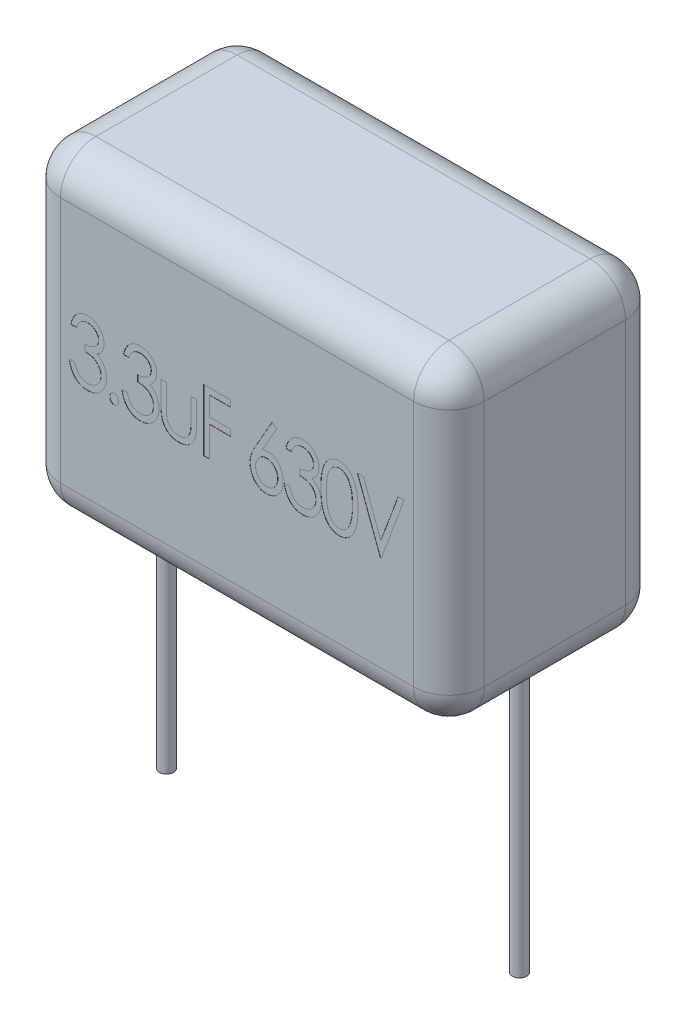
from build123d import *

# Parameters (mm, degrees)
BOSS_EXTRUDE1_DEPTH = 12
FILLET1_R           = 2
SKETCH2_R           = 0.4
BOSS_EXTRUDE2_DEPTH = 24
CUT_EXTRUDE1_DEPTH  = 0.01


with BuildPart() as part:
    # Sketch1 → Boss-Extrude1 (new, symmetric)
    with BuildSketch(Plane(origin=(0, 0, 0), x_dir=(0, 0, -1), z_dir=(1, 0, 0))):
        with BuildLine():
            Line((-4, 9), (4, 9))
            ThreePointArc((4, 9), (5.414213562, 8.414213562), (6, 7))
            Line((6, 7), (6, -7))
            ThreePointArc((6, -7), (5.414213562, -8.414213562), (4, -9))
            Line((4, -9), (-4, -9))
            ThreePointArc((-4, -9), (-5.414213562, -8.414213562), (-6, -7))
            Line((-6, -7), (-6, 7))
            ThreePointArc((-6, 7), (-5.414213562, 8.414213562), (-4, 9))
        make_face()
    extrude(amount=BOSS_EXTRUDE1_DEPTH, both=True)

    # Fillet1
    fillet1_edges = [part.edges().sort_by_distance(p)[0] for p in [
        (-12, 0, 6),
        (-12, 8.414213562, 5.414213562),
        (-12, 9, 0),
        (-12, 8.414213562, -5.414213562),
        (12, 8.414213562, 5.414213562),
        (12, 0, 6),
        (12, -8.414213562, 5.414213562),
        (12, -9, 0),
        (12, -8.414213562, -5.414213562),
        (12, 0, -6),
        (12, 8.414213562, -5.414213562),
        (-12, 0, -6),
        (12, 9, 0),
        (-12, -8.414213562, -5.414213562),
        (-12, -9, 0),
        (-12, -8.414213562, 5.414213562),
    ]]
    fillet(fillet1_edges, radius=FILLET1_R)

    # Sketch2 → Boss-Extrude2 (add)
    with BuildSketch(Plane(origin=(0, 0, 0), x_dir=(1, 0, 0), z_dir=(0, 1, 0))):
        with Locations(Location((10, 0, 0), (0, 0, 270))):
            Circle(SKETCH2_R)
        with Locations(Location((-10, 0, 0), (0, 0, 90))):
            Circle(SKETCH2_R)
    extrude(amount=-BOSS_EXTRUDE2_DEPTH)

    # Sketch3 → Cut-Extrude1 (cut)
    # profile 1 of 9: a face of its own
    with BuildSketch(Plane.XY.offset(6)):
        with BuildLine():
            Line((-9.104487179, 1.084449307), (-9.418589744, 1.084449307))
            add(Edge.make_bspline(
                [(-9.418589744, 1.084449307), (-9.410630849, 1.119621771), (-9.395115741, 1.188187152), (-9.364678553, 1.287066866), (-9.329026868, 1.379596381), (-9.288319285, 1.466091978), (-9.242881043, 1.546628643), (-9.191150702, 1.62031441), (-9.135523276, 1.688942013), (-9.073270229, 1.749431821), (-9.008482805, 1.804670638), (-8.939410705, 1.851330848), (-8.868133663, 1.891940262), (-8.7937364, 1.924991002), (-8.716119059, 1.950208155), (-8.635639902, 1.968433398), (-8.552344374, 1.980081874), (-8.495718117, 1.981280742), (-8.467167468, 1.981885204)],
                knots=[0, 0, 0, 0, 1.213646873, 2.365889363, 3.479226314, 4.54912843, 5.581579656, 6.587705624, 7.576924878, 8.55050232, 9.505464024, 10.439453725, 11.351887816, 12.264152294, 13.174752891, 14.094686289, 15.039351257, 16, 16, 16, 16], degree=3))
            add(Edge.make_bspline(
                [(-8.467167468, 1.981885204), (-8.425449637, 1.980492873), (-8.34271839, 1.977731719), (-8.221304333, 1.95285661), (-8.104287154, 1.91317393), (-7.992861731, 1.858728578), (-7.889349447, 1.791278593), (-7.797213807, 1.711402472), (-7.718079578, 1.620160897), (-7.652495716, 1.519084123), (-7.600279132, 1.411804455), (-7.56187533, 1.301052171), (-7.538541965, 1.18755313), (-7.535500608, 1.110964723), (-7.533974359, 1.072530236)],
                knots=[0, 0, 0, 0, 1.037475548, 2.057433109, 3.071083532, 4.106583696, 5.136003477, 6.138035553, 7.131860785, 8.132253496, 9.128731291, 10.094580144, 11.043800018, 12, 12, 12, 12], degree=3))
            add(Edge.make_bspline(
                [(-7.533974359, 1.072530236), (-7.535184897, 1.035527594), (-7.537552391, 0.963160107), (-7.556183875, 0.857560228), (-7.587073963, 0.757791469), (-7.630911491, 0.664045362), (-7.686931658, 0.57606498), (-7.75555274, 0.494633183), (-7.836120926, 0.418600102), (-7.897295303, 0.374910855), (-7.928705929, 0.352478153)],
                knots=[0, 0, 0, 0, 1.034740432, 2.023681557, 2.989439786, 3.948891607, 4.910213012, 5.898894732, 6.921165452, 8, 8, 8, 8], degree=3))
            add(Edge.make_bspline(
                [(-7.928705929, 0.352478153), (-7.895208912, 0.334416009), (-7.828339892, 0.298359129), (-7.737736103, 0.228658559), (-7.655769576, 0.147586852), (-7.610288743, 0.08532595), (-7.587259615, 0.053800268)],
                knots=[0, 0, 0, 0, 0.994457701, 1.985203988, 2.979812114, 4, 4, 4, 4], degree=3))
            add(Edge.make_bspline(
                [(-7.587259615, 0.053800268), (-7.572095275, 0.030689639), (-7.541895784, -0.015334731), (-7.504689681, -0.088567443), (-7.471887283, -0.163317834), (-7.445333873, -0.240206226), (-7.424971341, -0.319265714), (-7.410290328, -0.400331456), (-7.400777879, -0.483499262), (-7.399833718, -0.539790424), (-7.399358974, -0.568094764)],
                knots=[0, 0, 0, 0, 1.00515716, 2.001751025, 2.984458985, 3.97420733, 4.958128942, 5.952324961, 6.970387383, 8, 8, 8, 8], degree=3))
            add(Edge.make_bspline(
                [(-7.399358974, -0.568094764), (-7.401227248, -0.617043772), (-7.404945278, -0.714456593), (-7.431441341, -0.859093824), (-7.476977552, -0.99954047), (-7.538235862, -1.135005692), (-7.614423862, -1.261173268), (-7.705000809, -1.374109033), (-7.808800459, -1.471687046), (-7.924880272, -1.552972722), (-8.050602099, -1.61821072), (-8.18526605, -1.66330333), (-8.326824664, -1.692906122), (-8.424013034, -1.696018112), (-8.473477564, -1.697601975)],
                knots=[0, 0, 0, 0, 1.014707837, 2.019357588, 3.036907717, 4.069166202, 5.095504868, 6.084608755, 7.061626644, 8.038980938, 9.014218756, 9.987287233, 10.975619287, 12, 12, 12, 12], degree=3))
            add(Edge.make_bspline(
                [(-8.473477564, -1.697601975), (-8.506693909, -1.696739553), (-8.571942084, -1.695045463), (-8.667859233, -1.683306668), (-8.759270158, -1.661923167), (-8.846639675, -1.633216243), (-8.930062443, -1.5964789), (-9.009452367, -1.551717486), (-9.084222141, -1.49786651), (-9.154292883, -1.435985015), (-9.219782568, -1.366634156), (-9.27876922, -1.288809293), (-9.332148008, -1.203588951), (-9.379783947, -1.110959908), (-9.421250538, -1.010517011), (-9.456761192, -0.902716456), (-9.486441617, -0.786975079), (-9.500898371, -0.706789383), (-9.508333333, -0.665550693)],
                knots=[0, 0, 0, 0, 0.990513423, 1.945704551, 2.875515556, 3.785713825, 4.684393021, 5.589454026, 6.498450854, 7.426798081, 8.373433753, 9.338011181, 10.333830724, 11.368661367, 12.440314751, 13.570898844, 14.750737914, 16, 16, 16, 16], degree=3))
            Line((-9.508333333, -0.665550693), (-9.194230769, -0.665550693))
            add(Edge.make_bspline(
                [(-9.194230769, -0.665550693), (-9.187553589, -0.692522395), (-9.174568719, -0.744973284), (-9.150148472, -0.819755632), (-9.125642197, -0.889488329), (-9.097259177, -0.952758664), (-9.067218088, -1.010465925), (-9.035000825, -1.062748731), (-9.000278538, -1.109056569), (-8.974563297, -1.136221585), (-8.962159455, -1.149324732)],
                knots=[0, 0, 0, 0, 1.227409514, 2.386898646, 3.474821375, 4.49196229, 5.448190758, 6.348047463, 7.203174547, 8, 8, 8, 8], degree=3))
            add(Edge.make_bspline(
                [(-8.962159455, -1.149324732), (-8.945612096, -1.164387947), (-8.91283868, -1.194221892), (-8.858951896, -1.232827914), (-8.802300062, -1.266404533), (-8.741265914, -1.291685347), (-8.678032605, -1.313468303), (-8.610924314, -1.327678323), (-8.540599717, -1.337320724), (-8.492442418, -1.338186053), (-8.46786859, -1.338627616)],
                knots=[0, 0, 0, 0, 0.987786239, 1.956392453, 2.923291289, 3.889914458, 4.869410071, 5.873943724, 6.915110651, 8, 8, 8, 8], degree=3))
            add(Edge.make_bspline(
                [(-8.46786859, -1.338627616), (-8.440014216, -1.33802707), (-8.385733207, -1.33685676), (-8.306531859, -1.325605303), (-8.231250222, -1.309686576), (-8.16068096, -1.284243051), (-8.093424359, -1.253848391), (-8.03113643, -1.214952312), (-7.972967352, -1.169485989), (-7.919412734, -1.118015991), (-7.871584216, -1.061470887), (-7.829317215, -1.002419283), (-7.792922407, -0.941256463), (-7.764615467, -0.87692417), (-7.740811088, -0.810852492), (-7.724857821, -0.741907377), (-7.71578781, -0.67070165), (-7.714242681, -0.622574022), (-7.713461538, -0.598243001)],
                knots=[0, 0, 0, 0, 1.131388683, 2.204785482, 3.246441662, 4.252851856, 5.247356788, 6.241181003, 7.22926868, 8.243715995, 9.254465245, 10.235036049, 11.192984918, 12.141087045, 13.087426855, 14.043631555, 15.010953923, 16, 16, 16, 16], degree=3))
            add(Edge.make_bspline(
                [(-7.713461538, -0.598243001), (-7.714656893, -0.56566472), (-7.717033722, -0.500886478), (-7.736710516, -0.405583378), (-7.768397271, -0.313598154), (-7.812725247, -0.226394272), (-7.866750214, -0.145568417), (-7.930142032, -0.073635542), (-8.00340136, -0.013730792), (-8.071342626, 0.027935112), (-8.1317229, 0.055665105), (-8.182973746, 0.074697685), (-8.240168963, 0.090282198), (-8.302740463, 0.105301445), (-8.371578737, 0.117702947), (-8.446207718, 0.128010123), (-8.526639941, 0.136556776), (-8.582135361, 0.140235178), (-8.610897436, 0.142141615)],
                knots=[0, 0, 0, 0, 1.19277501, 2.371698767, 3.54972029, 4.748382554, 5.945391955, 7.103829679, 8.24739154, 9.400245482, 10.013276171, 10.679775806, 11.400814213, 12.18386578, 13.037095876, 13.962316118, 14.943912534, 16, 16, 16, 16], degree=3))
            Line((-8.610897436, 0.142141615), (-8.610897436, 0.501115974))
            add(Edge.make_bspline(
                [(-8.610897436, 0.501115974), (-8.57413237, 0.501870988), (-8.50186619, 0.50335506), (-8.396577428, 0.520596125), (-8.295637834, 0.545184775), (-8.201637256, 0.581649017), (-8.115917131, 0.625078056), (-8.041381158, 0.674621633), (-7.979950446, 0.73075846), (-7.930939729, 0.792440597), (-7.893728279, 0.858444719), (-7.867591621, 0.927771859), (-7.850459119, 0.999712964), (-7.848875171, 1.049062326), (-7.848076923, 1.07393248)],
                knots=[0, 0, 0, 0, 1.243740816, 2.444722913, 3.604071008, 4.756374622, 5.850061341, 6.853181308, 7.777365241, 8.656145985, 9.510167359, 10.331781837, 11.159283104, 12, 12, 12, 12], degree=3))
            add(Edge.make_bspline(
                [(-7.848076923, 1.07393248), (-7.848601087, 1.092195382), (-7.849641623, 1.128449715), (-7.858368678, 1.181525952), (-7.871852444, 1.232981654), (-7.890482799, 1.282555083), (-7.915627078, 1.330054011), (-7.945740036, 1.375759282), (-7.981768652, 1.419175718), (-8.022450187, 1.460310839), (-8.066581267, 1.499000594), (-8.115298077, 1.531567216), (-8.166206468, 1.560197508), (-8.2200405, 1.583189796), (-8.276920766, 1.600884619), (-8.336561387, 1.613312564), (-8.399182437, 1.62123049), (-8.441903119, 1.622343805), (-8.463661859, 1.622910845)],
                knots=[0, 0, 0, 0, 0.954298075, 1.894410913, 2.804261135, 3.732387345, 4.655998667, 5.60826082, 6.589174048, 7.600068601, 8.631142096, 9.651225118, 10.65760524, 11.681194716, 12.705294547, 13.766901717, 14.862625692, 16, 16, 16, 16], degree=3))
            add(Edge.make_bspline(
                [(-8.463661859, 1.622910845), (-8.498624483, 1.621522296), (-8.567018845, 1.618805997), (-8.665547842, 1.594774807), (-8.757097116, 1.55666438), (-8.826657127, 1.511339593), (-8.877684738, 1.466535783), (-8.914941375, 1.42799586), (-8.950289103, 1.383679424), (-8.984447879, 1.334353339), (-9.016372449, 1.279072212), (-9.048365355, 1.219619238), (-9.077625723, 1.15407544), (-9.095348617, 1.108136883), (-9.104487179, 1.084449307)],
                knots=[0, 0, 0, 0, 1.395445339, 2.729789254, 4.027341734, 5.343352216, 6.025171276, 6.738565338, 7.482488129, 8.288221053, 9.133992859, 10.032284056, 10.985374711, 12, 12, 12, 12], degree=3))
        make_face()
    # profile 2 of 9: a face of its own
    with BuildSketch(Plane.XY.offset(6)):
        with BuildLine():
            add(Edge.make_bspline(
                [(-6.964102564, -1.069396847), (-6.947625024, -1.070552001), (-6.915098748, -1.072832249), (-6.86804703, -1.08889449), (-6.825363603, -1.116333061), (-6.78796813, -1.153707634), (-6.756580334, -1.197981827), (-6.733979206, -1.248235378), (-6.719125881, -1.302957771), (-6.717925142, -1.341331044), (-6.717307692, -1.361063514)],
                knots=[0, 0, 0, 0, 0.932051743, 1.839848197, 2.779380411, 3.780329255, 4.815317283, 5.833513928, 6.885940208, 8, 8, 8, 8], degree=3))
            add(Edge.make_bspline(
                [(-6.717307692, -1.361063514), (-6.717964096, -1.380322443), (-6.719255634, -1.41821624), (-6.733945384, -1.472511656), (-6.756785116, -1.522835575), (-6.787730838, -1.567636718), (-6.825366073, -1.60514347), (-6.868187728, -1.632340573), (-6.914949943, -1.649500061), (-6.947600749, -1.651645745), (-6.964102564, -1.65273018)],
                knots=[0, 0, 0, 0, 1.089197406, 2.143100788, 3.162726492, 4.210031689, 5.212385385, 6.153236251, 7.066640104, 8, 8, 8, 8], degree=3))
            add(Edge.make_bspline(
                [(-6.964102564, -1.65273018), (-6.980604379, -1.651645745), (-7.013255185, -1.649500061), (-7.0600174, -1.632340573), (-7.102839055, -1.60514347), (-7.14047429, -1.567636718), (-7.171420012, -1.522835575), (-7.194259744, -1.472511656), (-7.208949494, -1.41821624), (-7.210241032, -1.380322443), (-7.210897436, -1.361063514)],
                knots=[0, 0, 0, 0, 0.933359896, 1.846763749, 2.787614615, 3.789968311, 4.837273508, 5.856899212, 6.910802594, 8, 8, 8, 8], degree=3))
            add(Edge.make_bspline(
                [(-7.210897436, -1.361063514), (-7.210279987, -1.341331044), (-7.209079247, -1.302957771), (-7.194225922, -1.248235378), (-7.171624794, -1.197981827), (-7.140236998, -1.153707634), (-7.102841525, -1.116333061), (-7.060158098, -1.08889449), (-7.013106381, -1.072832249), (-6.980580104, -1.070552001), (-6.964102564, -1.069396847)],
                knots=[0, 0, 0, 0, 1.114059792, 2.166486072, 3.184682717, 4.219670745, 5.220619589, 6.160151803, 7.067948257, 8, 8, 8, 8], degree=3))
        make_face()
    # profile 3 of 9: a face of its own
    with BuildSketch(Plane.XY.offset(6)):
        with BuildLine():
            Line((-6.125, 1.084449307), (-6.439102564, 1.084449307))
            add(Edge.make_bspline(
                [(-6.439102564, 1.084449307), (-6.43114367, 1.119621771), (-6.415628562, 1.188187152), (-6.385191374, 1.287066866), (-6.349539689, 1.379596381), (-6.308832105, 1.466091978), (-6.263393864, 1.546628643), (-6.211663522, 1.62031441), (-6.156036097, 1.688942013), (-6.093783049, 1.749431821), (-6.028995625, 1.804670638), (-5.959923525, 1.851330848), (-5.888646483, 1.891940262), (-5.81424922, 1.924991002), (-5.736631879, 1.950208155), (-5.656152723, 1.968433398), (-5.572857195, 1.980081874), (-5.516230937, 1.981280742), (-5.487680288, 1.981885204)],
                knots=[0, 0, 0, 0, 1.213646873, 2.365889363, 3.479226314, 4.54912843, 5.581579656, 6.587705624, 7.576924878, 8.55050232, 9.505464024, 10.439453725, 11.351887816, 12.264152294, 13.174752891, 14.094686289, 15.039351257, 16, 16, 16, 16], degree=3))
            add(Edge.make_bspline(
                [(-5.487680288, 1.981885204), (-5.445962458, 1.980492873), (-5.363231211, 1.977731719), (-5.241817154, 1.95285661), (-5.124799974, 1.91317393), (-5.013374551, 1.858728578), (-4.909862267, 1.791278593), (-4.817726627, 1.711402472), (-4.738592399, 1.620160897), (-4.673008536, 1.519084123), (-4.620791953, 1.411804455), (-4.582388151, 1.301052171), (-4.559054785, 1.18755313), (-4.556013429, 1.110964723), (-4.554487179, 1.072530236)],
                knots=[0, 0, 0, 0, 1.037475548, 2.057433109, 3.071083532, 4.106583696, 5.136003477, 6.138035553, 7.131860785, 8.132253496, 9.128731291, 10.094580144, 11.043800018, 12, 12, 12, 12], degree=3))
            add(Edge.make_bspline(
                [(-4.554487179, 1.072530236), (-4.555697717, 1.035527594), (-4.558065212, 0.963160107), (-4.576696695, 0.857560228), (-4.607586783, 0.757791469), (-4.651424312, 0.664045362), (-4.707444478, 0.57606498), (-4.77606556, 0.494633183), (-4.856633746, 0.418600102), (-4.917808124, 0.374910855), (-4.94921875, 0.352478153)],
                knots=[0, 0, 0, 0, 1.034740432, 2.023681557, 2.989439786, 3.948891607, 4.910213012, 5.898894732, 6.921165452, 8, 8, 8, 8], degree=3))
            add(Edge.make_bspline(
                [(-4.94921875, 0.352478153), (-4.915721733, 0.334416009), (-4.848852713, 0.298359129), (-4.758248923, 0.228658559), (-4.676282397, 0.147586852), (-4.630801564, 0.08532595), (-4.607772436, 0.053800268)],
                knots=[0, 0, 0, 0, 0.994457701, 1.985203988, 2.979812114, 4, 4, 4, 4], degree=3))
            add(Edge.make_bspline(
                [(-4.607772436, 0.053800268), (-4.592608095, 0.030689639), (-4.562408604, -0.015334731), (-4.525202501, -0.088567443), (-4.492400103, -0.163317834), (-4.465846693, -0.240206226), (-4.445484161, -0.319265714), (-4.430803149, -0.400331456), (-4.421290699, -0.483499262), (-4.420346538, -0.539790424), (-4.419871795, -0.568094764)],
                knots=[0, 0, 0, 0, 1.00515716, 2.001751025, 2.984458985, 3.97420733, 4.958128942, 5.952324961, 6.970387383, 8, 8, 8, 8], degree=3))
            add(Edge.make_bspline(
                [(-4.419871795, -0.568094764), (-4.421740069, -0.617043772), (-4.425458098, -0.714456593), (-4.451954162, -0.859093824), (-4.497490372, -0.99954047), (-4.558748682, -1.135005692), (-4.634936683, -1.261173268), (-4.725513629, -1.374109033), (-4.829313279, -1.471687046), (-4.945393092, -1.552972722), (-5.07111492, -1.61821072), (-5.20577887, -1.66330333), (-5.347337485, -1.692906122), (-5.444525854, -1.696018112), (-5.493990385, -1.697601975)],
                knots=[0, 0, 0, 0, 1.014707837, 2.019357588, 3.036907717, 4.069166202, 5.095504868, 6.084608755, 7.061626644, 8.038980938, 9.014218756, 9.987287233, 10.975619287, 12, 12, 12, 12], degree=3))
            add(Edge.make_bspline(
                [(-5.493990385, -1.697601975), (-5.527206729, -1.696739553), (-5.592454904, -1.695045463), (-5.688372054, -1.683306668), (-5.779782979, -1.661923167), (-5.867152495, -1.633216243), (-5.950575263, -1.5964789), (-6.029965187, -1.551717486), (-6.104734962, -1.49786651), (-6.174805704, -1.435985015), (-6.240295388, -1.366634156), (-6.29928204, -1.288809293), (-6.352660829, -1.203588951), (-6.400296768, -1.110959908), (-6.441763358, -1.010517011), (-6.477274012, -0.902716456), (-6.506954437, -0.786975079), (-6.521411192, -0.706789383), (-6.528846154, -0.665550693)],
                knots=[0, 0, 0, 0, 0.990513423, 1.945704551, 2.875515556, 3.785713825, 4.684393021, 5.589454026, 6.498450854, 7.426798081, 8.373433753, 9.338011181, 10.333830724, 11.368661367, 12.440314751, 13.570898844, 14.750737914, 16, 16, 16, 16], degree=3))
            Line((-6.528846154, -0.665550693), (-6.21474359, -0.665550693))
            add(Edge.make_bspline(
                [(-6.21474359, -0.665550693), (-6.208066409, -0.692522395), (-6.195081539, -0.744973284), (-6.170661293, -0.819755632), (-6.146155017, -0.889488329), (-6.117771998, -0.952758664), (-6.087730909, -1.010465925), (-6.055513645, -1.062748731), (-6.020791358, -1.109056569), (-5.995076118, -1.136221585), (-5.982672276, -1.149324732)],
                knots=[0, 0, 0, 0, 1.227409514, 2.386898646, 3.474821375, 4.49196229, 5.448190758, 6.348047463, 7.203174547, 8, 8, 8, 8], degree=3))
            add(Edge.make_bspline(
                [(-5.982672276, -1.149324732), (-5.966124916, -1.164387947), (-5.933351501, -1.194221892), (-5.879464716, -1.232827914), (-5.822812882, -1.266404533), (-5.761778734, -1.291685347), (-5.698545425, -1.313468303), (-5.631437135, -1.327678323), (-5.561112537, -1.337320724), (-5.512955238, -1.338186053), (-5.48838141, -1.338627616)],
                knots=[0, 0, 0, 0, 0.987786239, 1.956392453, 2.923291289, 3.889914458, 4.869410071, 5.873943724, 6.915110651, 8, 8, 8, 8], degree=3))
            add(Edge.make_bspline(
                [(-5.48838141, -1.338627616), (-5.460527036, -1.33802707), (-5.406246027, -1.33685676), (-5.32704468, -1.325605303), (-5.251763042, -1.309686576), (-5.18119378, -1.284243051), (-5.113937179, -1.253848391), (-5.051649251, -1.214952312), (-4.993480172, -1.169485989), (-4.939925554, -1.118015991), (-4.892097037, -1.061470887), (-4.849830035, -1.002419283), (-4.813435227, -0.941256463), (-4.785128288, -0.87692417), (-4.761323909, -0.810852492), (-4.745370641, -0.741907377), (-4.73630063, -0.67070165), (-4.734755502, -0.622574022), (-4.733974359, -0.598243001)],
                knots=[0, 0, 0, 0, 1.131388683, 2.204785482, 3.246441662, 4.252851856, 5.247356788, 6.241181003, 7.22926868, 8.243715995, 9.254465245, 10.235036049, 11.192984918, 12.141087045, 13.087426855, 14.043631555, 15.010953923, 16, 16, 16, 16], degree=3))
            add(Edge.make_bspline(
                [(-4.733974359, -0.598243001), (-4.735169714, -0.56566472), (-4.737546542, -0.500886478), (-4.757223336, -0.405583378), (-4.788910091, -0.313598154), (-4.833238068, -0.226394272), (-4.887263035, -0.145568417), (-4.950654853, -0.073635542), (-5.02391418, -0.013730792), (-5.091855446, 0.027935112), (-5.15223572, 0.055665105), (-5.203486567, 0.074697685), (-5.260681783, 0.090282198), (-5.323253284, 0.105301445), (-5.392091557, 0.117702947), (-5.466720539, 0.128010123), (-5.547152761, 0.136556776), (-5.602648181, 0.140235178), (-5.631410256, 0.142141615)],
                knots=[0, 0, 0, 0, 1.19277501, 2.371698767, 3.54972029, 4.748382554, 5.945391955, 7.103829679, 8.24739154, 9.400245482, 10.013276171, 10.679775806, 11.400814213, 12.18386578, 13.037095876, 13.962316118, 14.943912534, 16, 16, 16, 16], degree=3))
            Line((-5.631410256, 0.142141615), (-5.631410256, 0.501115974))
            add(Edge.make_bspline(
                [(-5.631410256, 0.501115974), (-5.594645191, 0.501870988), (-5.522379011, 0.50335506), (-5.417090249, 0.520596125), (-5.316150655, 0.545184775), (-5.222150077, 0.581649017), (-5.136429951, 0.625078056), (-5.061893979, 0.674621633), (-5.000463266, 0.73075846), (-4.95145255, 0.792440597), (-4.9142411, 0.858444719), (-4.888104441, 0.927771859), (-4.870971939, 0.999712964), (-4.869387992, 1.049062326), (-4.868589744, 1.07393248)],
                knots=[0, 0, 0, 0, 1.243740816, 2.444722913, 3.604071008, 4.756374622, 5.850061341, 6.853181308, 7.777365241, 8.656145985, 9.510167359, 10.331781837, 11.159283104, 12, 12, 12, 12], degree=3))
            add(Edge.make_bspline(
                [(-4.868589744, 1.07393248), (-4.869113908, 1.092195382), (-4.870154444, 1.128449715), (-4.878881498, 1.181525952), (-4.892365265, 1.232981654), (-4.910995619, 1.282555083), (-4.936139898, 1.330054011), (-4.966252857, 1.375759282), (-5.002281473, 1.419175718), (-5.042963007, 1.460310839), (-5.087094087, 1.499000594), (-5.135810898, 1.531567216), (-5.186719289, 1.560197508), (-5.24055332, 1.583189796), (-5.297433586, 1.600884619), (-5.357074208, 1.613312564), (-5.419695257, 1.62123049), (-5.462415939, 1.622343805), (-5.484174679, 1.622910845)],
                knots=[0, 0, 0, 0, 0.954298075, 1.894410913, 2.804261135, 3.732387345, 4.655998667, 5.60826082, 6.589174048, 7.600068601, 8.631142096, 9.651225118, 10.65760524, 11.681194716, 12.705294547, 13.766901717, 14.862625692, 16, 16, 16, 16], degree=3))
            add(Edge.make_bspline(
                [(-5.484174679, 1.622910845), (-5.519137303, 1.621522296), (-5.587531666, 1.618805997), (-5.686060663, 1.594774807), (-5.777609936, 1.55666438), (-5.847169948, 1.511339593), (-5.898197558, 1.466535783), (-5.935454196, 1.42799586), (-5.970801924, 1.383679424), (-6.0049607, 1.334353339), (-6.03688527, 1.279072212), (-6.068878175, 1.219619238), (-6.098138543, 1.15407544), (-6.115861437, 1.108136883), (-6.125, 1.084449307)],
                knots=[0, 0, 0, 0, 1.395445339, 2.729789254, 4.027341734, 5.343352216, 6.025171276, 6.738565338, 7.482488129, 8.288221053, 9.133992859, 10.032284056, 10.985374711, 12, 12, 12, 12], degree=3))
        make_face()
    # profile 4 of 9: a face of its own
    with BuildSketch(Plane.XY.offset(6)):
        with BuildLine():
            Line((-4.321153846, 0.949833922), (-4.007051282, 0.949833922))
            Line((-4.007051282, 0.949833922), (-4.007051282, -0.236464155))
            add(Edge.make_bspline(
                [(-4.007051282, -0.236464155), (-4.006960563, -0.271288887), (-4.006787022, -0.33790697), (-4.004278838, -0.433717605), (-4.00217461, -0.521186389), (-3.996837223, -0.600150991), (-3.991557237, -0.670796052), (-3.984672364, -0.732780735), (-3.976568594, -0.786668539), (-3.969132318, -0.819364317), (-3.965685096, -0.834521046)],
                knots=[0, 0, 0, 0, 1.391532709, 2.661936892, 3.829901352, 4.887223925, 5.824101155, 6.660496541, 7.379048576, 8, 8, 8, 8], degree=3))
            add(Edge.make_bspline(
                [(-3.965685096, -0.834521046), (-3.954048131, -0.871929544), (-3.931363725, -0.944851434), (-3.87738502, -1.044398785), (-3.810279935, -1.131904843), (-3.72910851, -1.205996103), (-3.636292486, -1.264633669), (-3.534550559, -1.308464865), (-3.423569121, -1.334065176), (-3.346726835, -1.337081317), (-3.307331731, -1.338627616)],
                knots=[0, 0, 0, 0, 1.047486636, 2.041907865, 3.014989621, 3.990003216, 4.969629675, 5.943033671, 6.945445186, 8, 8, 8, 8], degree=3))
            add(Edge.make_bspline(
                [(-3.307331731, -1.338627616), (-3.268172861, -1.33704639), (-3.192077784, -1.333973689), (-3.082606803, -1.309137615), (-2.982649035, -1.267027326), (-2.892891648, -1.2092371), (-2.813791515, -1.13831707), (-2.748523938, -1.055047479), (-2.694174959, -0.962528273), (-2.671181597, -0.894391851), (-2.659495192, -0.85976143)],
                knots=[0, 0, 0, 0, 1.083224142, 2.104964324, 3.087867758, 4.071345921, 5.047068855, 6.014022567, 6.990624521, 8, 8, 8, 8], degree=3))
            add(Edge.make_bspline(
                [(-2.659495192, -0.85976143), (-2.655726897, -0.845794504), (-2.647390905, -0.814897721), (-2.639975078, -0.762399902), (-2.632018861, -0.700052971), (-2.625768993, -0.627080904), (-2.622156461, -0.543806473), (-2.618372413, -0.450334388), (-2.616409132, -0.346782218), (-2.616157255, -0.274325345), (-2.616025641, -0.236464155)],
                knots=[0, 0, 0, 0, 0.553958893, 1.225434092, 2.028671365, 2.963679295, 4.030914419, 5.223034872, 6.548940879, 8, 8, 8, 8], degree=3))
            Line((-2.616025641, -0.236464155), (-2.616025641, 0.949833922))
            Line((-2.616025641, 0.949833922), (-2.301923077, 0.949833922))
            Line((-2.301923077, 0.949833922), (-2.301923077, -0.295358385))
            add(Edge.make_bspline(
                [(-2.301923077, -0.295358385), (-2.302025808, -0.337669362), (-2.302225127, -0.41976148), (-2.308503267, -0.538961655), (-2.315987086, -0.650162745), (-2.32921326, -0.753201062), (-2.344019698, -0.848075261), (-2.362733912, -0.935081309), (-2.386062565, -1.013608859), (-2.419796967, -1.106905302), (-2.472229426, -1.212067205), (-2.54970342, -1.324451316), (-2.641389666, -1.422751981), (-2.729109946, -1.491905049), (-2.806054174, -1.538814522), (-2.867356836, -1.569677521), (-2.932584377, -1.594794974), (-3.000964827, -1.615955016), (-3.073097664, -1.632793061), (-3.148798142, -1.644500877), (-3.227961149, -1.651768225), (-3.281841321, -1.652404383), (-3.309435096, -1.65273018)],
                knots=[0, 0, 0, 0, 1.312098829, 2.54574533, 3.701569955, 4.767896179, 5.766537578, 6.679358675, 7.525722669, 8.305423759, 9.754479426, 11.155959474, 12.525277459, 13.908701379, 14.604880684, 15.31806066, 16.034181596, 16.770167898, 17.536786682, 18.329287869, 19.144374379, 20, 20, 20, 20], degree=3))
            add(Edge.make_bspline(
                [(-3.309435096, -1.65273018), (-3.337027541, -1.652391286), (-3.391137956, -1.651726693), (-3.47032042, -1.644615942), (-3.545995701, -1.632717676), (-3.618111538, -1.615862338), (-3.686964909, -1.594771758), (-3.752762702, -1.569866138), (-3.814330918, -1.538608266), (-3.891965938, -1.492115094), (-3.980387462, -1.422667347), (-4.072966032, -1.32388263), (-4.149949414, -1.2096722), (-4.203336629, -1.103755783), (-4.237086837, -1.009179098), (-4.260538405, -0.929033554), (-4.278838879, -0.840076971), (-4.29407579, -0.742709901), (-4.306951775, -0.637285934), (-4.314648168, -0.523073995), (-4.320844205, -0.400594165), (-4.32104841, -0.315933866), (-4.321153846, -0.272221366)],
                knots=[0, 0, 0, 0, 0.844445595, 1.656007694, 2.431087477, 3.187689243, 3.920896429, 4.634327057, 5.338188272, 6.031389025, 7.402366307, 8.763903704, 10.158861678, 11.604980077, 12.381214554, 13.230253831, 14.159118366, 15.158838041, 16.246741172, 17.408865503, 18.662124194, 20, 20, 20, 20], degree=3))
            Line((-4.321153846, -0.272221366), (-4.321153846, 0.949833922))
        make_face()
    # profile 5 of 9: a face of its own
    with BuildSketch(Plane.XY.offset(6)):
        Polygon((-1.889102564, 1.892141615), (-0.363461538, 1.892141615), (-0.363461538, 1.533167256), (-1.575, 1.533167256), (-1.575, 0.456244179), (-0.363461538, 0.456244179), (-0.363461538, 0.09726982), (-1.575, 0.09726982), (-1.575, -1.607858385), (-1.889102564, -1.607858385), align=None)
    # profile 6 of 9: a face of its own
    with BuildSketch(Plane.XY.offset(6)):
        with BuildLine():
            Line((1.987820513, 1.981885204), (2.246534455, 1.779261006))
            Line((2.246534455, 1.779261006), (1.439543269, 0.368603954))
            add(Edge.make_bspline(
                [(1.439543269, 0.368603954), (1.466812634, 0.37526442), (1.52010485, 0.388280894), (1.599527188, 0.401485605), (1.6761233, 0.409489083), (1.726284139, 0.410753409), (1.750841346, 0.411372384)],
                knots=[0, 0, 0, 0, 1.069017442, 2.089168874, 3.064515738, 4, 4, 4, 4], degree=3))
            add(Edge.make_bspline(
                [(1.750841346, 0.411372384), (1.780344363, 0.410395966), (1.838750533, 0.408462983), (1.92437791, 0.394099143), (2.006820475, 0.370921316), (2.085544985, 0.337662549), (2.160981934, 0.29527459), (2.233083272, 0.243726942), (2.30104381, 0.182187869), (2.365189221, 0.112523269), (2.423348005, 0.03570257), (2.475955502, -0.045262387), (2.518300997, -0.131847484), (2.554890807, -0.22174288), (2.581469922, -0.316930019), (2.602545239, -0.415856308), (2.613248401, -0.519482951), (2.615089193, -0.589809966), (2.616025641, -0.625586751)],
                knots=[0, 0, 0, 0, 0.94270807, 1.866248726, 2.767185609, 3.674541525, 4.590954703, 5.527962652, 6.501338954, 7.516419256, 8.550346355, 9.578210583, 10.597159334, 11.626461306, 12.676190005, 13.75154867, 14.856166998, 16, 16, 16, 16], degree=3))
            add(Edge.make_bspline(
                [(2.616025641, -0.625586751), (2.614620791, -0.674531038), (2.611861914, -0.770648911), (2.58788071, -0.910811557), (2.550230123, -1.044284603), (2.496289651, -1.169328409), (2.428415353, -1.284724204), (2.346899707, -1.388106963), (2.252945628, -1.479596542), (2.146705666, -1.556775177), (2.032169961, -1.619172274), (1.91176786, -1.664766029), (1.786662593, -1.692206812), (1.701661966, -1.695798875), (1.658994391, -1.697601975)],
                knots=[0, 0, 0, 0, 1.100029193, 2.160261625, 3.188348283, 4.212531226, 5.214007029, 6.19084986, 7.16470451, 8.153968429, 9.134706228, 10.089452316, 11.040966659, 12, 12, 12, 12], degree=3))
            add(Edge.make_bspline(
                [(1.658994391, -1.697601975), (1.617726603, -1.696058583), (1.535759187, -1.692993046), (1.415393944, -1.666047615), (1.300000801, -1.621840625), (1.189895751, -1.561784458), (1.088268449, -1.485123889), (0.996955135, -1.393967808), (0.918011189, -1.288113091), (0.851327899, -1.169943964), (0.797650408, -1.042928333), (0.759865538, -0.909600076), (0.735694984, -0.772299257), (0.732846892, -0.678972681), (0.731410256, -0.631896847)],
                knots=[0, 0, 0, 0, 0.944369752, 1.875737749, 2.809318535, 3.767620574, 4.738711332, 5.715334409, 6.713191694, 7.753677133, 8.816521235, 9.863637142, 10.922374871, 12, 12, 12, 12], degree=3))
            add(Edge.make_bspline(
                [(0.731410256, -0.631896847), (0.73244701, -0.595864799), (0.734561502, -0.522376353), (0.749197097, -0.411028683), (0.772578613, -0.296991484), (0.805224437, -0.178402351), (0.851080573, -0.052840203), (0.911653685, 0.082777402), (0.985922438, 0.230718228), (1.043388187, 0.331709408), (1.073557692, 0.384729756)],
                knots=[0, 0, 0, 0, 0.796578147, 1.624645084, 2.47893077, 3.369018653, 4.341574185, 5.431288296, 6.651426929, 8, 8, 8, 8], degree=3))
            Line((1.073557692, 0.384729756), (1.987820513, 1.981885204))
        make_face()
        with BuildLine():
            add(Edge.make_bspline(
                [(1.673016827, 0.052398025), (1.651726537, 0.051601039), (1.609655738, 0.050026149), (1.547638158, 0.041232325), (1.488457955, 0.024438817), (1.431133554, 0.003186843), (1.376892305, -0.026226629), (1.324775675, -0.061464225), (1.274869796, -0.10291988), (1.228434672, -0.150375017), (1.185667416, -0.202166847), (1.147950803, -0.257209511), (1.115911484, -0.315082436), (1.090909525, -0.37600144), (1.07032216, -0.439198845), (1.055597846, -0.505130995), (1.047058287, -0.573944215), (1.04603538, -0.620654666), (1.045512821, -0.644517039)],
                knots=[0, 0, 0, 0, 0.980440822, 1.937405712, 2.874327233, 3.807349667, 4.745813954, 5.706580769, 6.699688098, 7.726654196, 8.758342519, 9.787784865, 10.794031938, 11.796995789, 12.814224172, 13.850389844, 14.90185603, 16, 16, 16, 16], degree=3))
            add(Edge.make_bspline(
                [(1.045512821, -0.644517039), (1.046028824, -0.668147505), (1.047038717, -0.714395673), (1.055696362, -0.782716264), (1.070175665, -0.848247939), (1.091095632, -0.91109576), (1.115700089, -0.971727872), (1.148178195, -1.029128472), (1.185636026, -1.084081252), (1.228446792, -1.135842159), (1.274852981, -1.183340295), (1.324828433, -1.224660609), (1.376787583, -1.260431761), (1.432066201, -1.288185082), (1.488948642, -1.310948115), (1.548374422, -1.327379285), (1.610347743, -1.336277177), (1.652424596, -1.337837833), (1.673717949, -1.338627616)],
                knots=[0, 0, 0, 0, 1.089616321, 2.132533514, 3.170816366, 4.179868319, 5.184881509, 6.183747772, 7.21529356, 8.249089914, 9.278154394, 10.273290922, 11.236020856, 12.180963788, 13.119799704, 14.05863562, 15.017555861, 16, 16, 16, 16], degree=3))
            add(Edge.make_bspline(
                [(1.673717949, -1.338627616), (1.695010948, -1.337837138), (1.737087101, -1.336275109), (1.799065537, -1.327387257), (1.858472368, -1.310918895), (1.915232192, -1.288371332), (1.970070831, -1.260216566), (2.021907731, -1.224678236), (2.071928708, -1.183373313), (2.118195506, -1.135578201), (2.16194414, -1.08454403), (2.198476029, -1.028894871), (2.230916475, -0.97159428), (2.256512407, -0.911263683), (2.27720467, -0.848225491), (2.291754583, -0.782722343), (2.300393214, -0.714394071), (2.301405732, -0.668146963), (2.301923077, -0.644517039)],
                knots=[0, 0, 0, 0, 0.982721893, 1.941913238, 2.881014579, 3.820115919, 4.755744149, 5.718746264, 6.714164134, 7.743519548, 8.78450012, 9.810291293, 10.809439953, 11.81894996, 12.82828719, 13.866863582, 14.910075626, 16, 16, 16, 16], degree=3))
            add(Edge.make_bspline(
                [(2.301923077, -0.644517039), (2.301399159, -0.620655215), (2.300373592, -0.573945838), (2.291853238, -0.50512486), (2.277058065, -0.439221338), (2.256700952, -0.375832566), (2.230702683, -0.315217025), (2.198700493, -0.257445189), (2.16191269, -0.201703702), (2.118206597, -0.150641129), (2.071916025, -0.102878621), (2.021945795, -0.061475848), (1.969846967, -0.026219674), (1.915596149, 0.003170629), (1.85808084, 0.024575479), (1.798599434, 0.041126014), (1.736383088, 0.050045403), (1.694308855, 0.051607508), (1.673016827, 0.052398025)],
                knots=[0, 0, 0, 0, 1.097086186, 2.147539549, 3.182707137, 4.198955676, 5.20515228, 6.210430088, 7.232854421, 8.270418297, 9.296395173, 10.288545893, 11.248387252, 12.185947565, 13.118071268, 14.064460489, 15.020503586, 16, 16, 16, 16], degree=3))
        make_face(mode=Mode.SUBTRACT)
    # profile 7 of 9: a face of its own
    with BuildSketch(Plane.XY.offset(6)):
        with BuildLine():
            Line((3.073717949, 1.084449307), (2.759615385, 1.084449307))
            add(Edge.make_bspline(
                [(2.759615385, 1.084449307), (2.767574279, 1.119621771), (2.783089387, 1.188187152), (2.813526575, 1.287066866), (2.84917826, 1.379596381), (2.889885843, 1.466091978), (2.935324085, 1.546628643), (2.987054426, 1.62031441), (3.042681852, 1.688942013), (3.1049349, 1.749431821), (3.169722324, 1.804670638), (3.238794424, 1.851330848), (3.310071465, 1.891940262), (3.384468728, 1.924991002), (3.46208607, 1.950208155), (3.542565226, 1.968433398), (3.625860754, 1.980081874), (3.682487011, 1.981280742), (3.71103766, 1.981885204)],
                knots=[0, 0, 0, 0, 1.213646873, 2.365889363, 3.479226314, 4.54912843, 5.581579656, 6.587705624, 7.576924878, 8.55050232, 9.505464024, 10.439453725, 11.351887816, 12.264152294, 13.174752891, 14.094686289, 15.039351257, 16, 16, 16, 16], degree=3))
            add(Edge.make_bspline(
                [(3.71103766, 1.981885204), (3.752755491, 1.980492873), (3.835486738, 1.977731719), (3.956900795, 1.95285661), (4.073917975, 1.91317393), (4.185343398, 1.858728578), (4.288855681, 1.791278593), (4.380991321, 1.711402472), (4.46012555, 1.620160897), (4.525709413, 1.519084123), (4.577925996, 1.411804455), (4.616329798, 1.301052171), (4.639663163, 1.18755313), (4.64270452, 1.110964723), (4.644230769, 1.072530236)],
                knots=[0, 0, 0, 0, 1.037475548, 2.057433109, 3.071083532, 4.106583696, 5.136003477, 6.138035553, 7.131860785, 8.132253496, 9.128731291, 10.094580144, 11.043800018, 12, 12, 12, 12], degree=3))
            add(Edge.make_bspline(
                [(4.644230769, 1.072530236), (4.643020232, 1.035527594), (4.640652737, 0.963160107), (4.622021254, 0.857560228), (4.591131166, 0.757791469), (4.547293637, 0.664045362), (4.49127347, 0.57606498), (4.422652389, 0.494633183), (4.342084202, 0.418600102), (4.280909825, 0.374910855), (4.249499199, 0.352478153)],
                knots=[0, 0, 0, 0, 1.034740432, 2.023681557, 2.989439786, 3.948891607, 4.910213012, 5.898894732, 6.921165452, 8, 8, 8, 8], degree=3))
            add(Edge.make_bspline(
                [(4.249499199, 0.352478153), (4.282996216, 0.334416009), (4.349865236, 0.298359129), (4.440469025, 0.228658559), (4.522435552, 0.147586852), (4.567916385, 0.08532595), (4.590945513, 0.053800268)],
                knots=[0, 0, 0, 0, 0.994457701, 1.985203988, 2.979812114, 4, 4, 4, 4], degree=3))
            add(Edge.make_bspline(
                [(4.590945513, 0.053800268), (4.606109854, 0.030689639), (4.636309345, -0.015334731), (4.673515448, -0.088567443), (4.706317846, -0.163317834), (4.732871255, -0.240206226), (4.753233787, -0.319265714), (4.7679148, -0.400331456), (4.77742725, -0.483499262), (4.778371411, -0.539790424), (4.778846154, -0.568094764)],
                knots=[0, 0, 0, 0, 1.00515716, 2.001751025, 2.984458985, 3.97420733, 4.958128942, 5.952324961, 6.970387383, 8, 8, 8, 8], degree=3))
            add(Edge.make_bspline(
                [(4.778846154, -0.568094764), (4.77697788, -0.617043772), (4.77325985, -0.714456593), (4.746763787, -0.859093824), (4.701227577, -0.99954047), (4.639969266, -1.135005692), (4.563781266, -1.261173268), (4.473204319, -1.374109033), (4.369404669, -1.471687046), (4.253324857, -1.552972722), (4.127603029, -1.61821072), (3.992939078, -1.66330333), (3.851380464, -1.692906122), (3.754192094, -1.696018112), (3.704727564, -1.697601975)],
                knots=[0, 0, 0, 0, 1.014707837, 2.019357588, 3.036907717, 4.069166202, 5.095504868, 6.084608755, 7.061626644, 8.038980938, 9.014218756, 9.987287233, 10.975619287, 12, 12, 12, 12], degree=3))
            add(Edge.make_bspline(
                [(3.704727564, -1.697601975), (3.671511219, -1.696739553), (3.606263044, -1.695045463), (3.510345895, -1.683306668), (3.41893497, -1.661923167), (3.331565453, -1.633216243), (3.248142685, -1.5964789), (3.168752761, -1.551717486), (3.093982987, -1.49786651), (3.023912245, -1.435985015), (2.958422561, -1.366634156), (2.899435908, -1.288809293), (2.84605712, -1.203588951), (2.798421181, -1.110959908), (2.756954591, -1.010517011), (2.721443936, -0.902716456), (2.691763512, -0.786975079), (2.677306757, -0.706789383), (2.669871795, -0.665550693)],
                knots=[0, 0, 0, 0, 0.990513423, 1.945704551, 2.875515556, 3.785713825, 4.684393021, 5.589454026, 6.498450854, 7.426798081, 8.373433753, 9.338011181, 10.333830724, 11.368661367, 12.440314751, 13.570898844, 14.750737914, 16, 16, 16, 16], degree=3))
            Line((2.669871795, -0.665550693), (2.983974359, -0.665550693))
            add(Edge.make_bspline(
                [(2.983974359, -0.665550693), (2.990651539, -0.692522395), (3.003636409, -0.744973284), (3.028056656, -0.819755632), (3.052562932, -0.889488329), (3.080945951, -0.952758664), (3.11098704, -1.010465925), (3.143204303, -1.062748731), (3.17792659, -1.109056569), (3.203641831, -1.136221585), (3.216045673, -1.149324732)],
                knots=[0, 0, 0, 0, 1.227409514, 2.386898646, 3.474821375, 4.49196229, 5.448190758, 6.348047463, 7.203174547, 8, 8, 8, 8], degree=3))
            add(Edge.make_bspline(
                [(3.216045673, -1.149324732), (3.232593032, -1.164387947), (3.265366448, -1.194221892), (3.319253232, -1.232827914), (3.375905066, -1.266404533), (3.436939214, -1.291685347), (3.500172524, -1.313468303), (3.567280814, -1.327678323), (3.637605411, -1.337320724), (3.685762711, -1.338186053), (3.710336538, -1.338627616)],
                knots=[0, 0, 0, 0, 0.987786239, 1.956392453, 2.923291289, 3.889914458, 4.869410071, 5.873943724, 6.915110651, 8, 8, 8, 8], degree=3))
            add(Edge.make_bspline(
                [(3.710336538, -1.338627616), (3.738190913, -1.33802707), (3.792471922, -1.33685676), (3.871673269, -1.325605303), (3.946954906, -1.309686576), (4.017524168, -1.284243051), (4.08478077, -1.253848391), (4.147068698, -1.214952312), (4.205237776, -1.169485989), (4.258792394, -1.118015991), (4.306620912, -1.061470887), (4.348887914, -1.002419283), (4.385282722, -0.941256463), (4.413589661, -0.87692417), (4.43739404, -0.810852492), (4.453347308, -0.741907377), (4.462417318, -0.67070165), (4.463962447, -0.622574022), (4.46474359, -0.598243001)],
                knots=[0, 0, 0, 0, 1.131388683, 2.204785482, 3.246441662, 4.252851856, 5.247356788, 6.241181003, 7.22926868, 8.243715995, 9.254465245, 10.235036049, 11.192984918, 12.141087045, 13.087426855, 14.043631555, 15.010953923, 16, 16, 16, 16], degree=3))
            add(Edge.make_bspline(
                [(4.46474359, -0.598243001), (4.463548235, -0.56566472), (4.461171407, -0.500886478), (4.441494612, -0.405583378), (4.409807858, -0.313598154), (4.365479881, -0.226394272), (4.311454914, -0.145568417), (4.248063096, -0.073635542), (4.174803769, -0.013730792), (4.106862502, 0.027935112), (4.046482228, 0.055665105), (3.995231382, 0.074697685), (3.938036165, 0.090282198), (3.875464665, 0.105301445), (3.806626392, 0.117702947), (3.73199741, 0.128010123), (3.651565188, 0.136556776), (3.596069768, 0.140235178), (3.567307692, 0.142141615)],
                knots=[0, 0, 0, 0, 1.19277501, 2.371698767, 3.54972029, 4.748382554, 5.945391955, 7.103829679, 8.24739154, 9.400245482, 10.013276171, 10.679775806, 11.400814213, 12.18386578, 13.037095876, 13.962316118, 14.943912534, 16, 16, 16, 16], degree=3))
            Line((3.567307692, 0.142141615), (3.567307692, 0.501115974))
            add(Edge.make_bspline(
                [(3.567307692, 0.501115974), (3.604072758, 0.501870988), (3.676338938, 0.50335506), (3.7816277, 0.520596125), (3.882567294, 0.545184775), (3.976567872, 0.581649017), (4.062287998, 0.625078056), (4.13682397, 0.674621633), (4.198254683, 0.73075846), (4.247265399, 0.792440597), (4.284476849, 0.858444719), (4.310613507, 0.927771859), (4.327746009, 0.999712964), (4.329329957, 1.049062326), (4.330128205, 1.07393248)],
                knots=[0, 0, 0, 0, 1.243740816, 2.444722913, 3.604071008, 4.756374622, 5.850061341, 6.853181308, 7.777365241, 8.656145985, 9.510167359, 10.331781837, 11.159283104, 12, 12, 12, 12], degree=3))
            add(Edge.make_bspline(
                [(4.330128205, 1.07393248), (4.329604041, 1.092195382), (4.328563505, 1.128449715), (4.319836451, 1.181525952), (4.306352684, 1.232981654), (4.287722329, 1.282555083), (4.26257805, 1.330054011), (4.232465092, 1.375759282), (4.196436476, 1.419175718), (4.155754942, 1.460310839), (4.111623861, 1.499000594), (4.062907051, 1.531567216), (4.01199866, 1.560197508), (3.958164628, 1.583189796), (3.901284363, 1.600884619), (3.841643741, 1.613312564), (3.779022692, 1.62123049), (3.73630201, 1.622343805), (3.714543269, 1.622910845)],
                knots=[0, 0, 0, 0, 0.954298075, 1.894410913, 2.804261135, 3.732387345, 4.655998667, 5.60826082, 6.589174048, 7.600068601, 8.631142096, 9.651225118, 10.65760524, 11.681194716, 12.705294547, 13.766901717, 14.862625692, 16, 16, 16, 16], degree=3))
            add(Edge.make_bspline(
                [(3.714543269, 1.622910845), (3.679580646, 1.621522296), (3.611186283, 1.618805997), (3.512657286, 1.594774807), (3.421108013, 1.55666438), (3.351548001, 1.511339593), (3.30052039, 1.466535783), (3.263263753, 1.42799586), (3.227916025, 1.383679424), (3.193757249, 1.334353339), (3.161832679, 1.279072212), (3.129839774, 1.219619238), (3.100579405, 1.15407544), (3.082856512, 1.108136883), (3.073717949, 1.084449307)],
                knots=[0, 0, 0, 0, 1.395445339, 2.729789254, 4.027341734, 5.343352216, 6.025171276, 6.738565338, 7.482488129, 8.288221053, 9.133992859, 10.032284056, 10.985374711, 12, 12, 12, 12], degree=3))
        make_face()
    # profile 8 of 9: a face of its own
    with BuildSketch(Plane.XY.offset(6)):
        with BuildLine():
            add(Edge.make_bspline(
                [(4.742948718, 0.140739371), (4.743298551, 0.19683749), (4.743978045, 0.305799079), (4.750765026, 0.464513079), (4.759724253, 0.613557658), (4.774903111, 0.752619052), (4.792638305, 0.881827165), (4.814998528, 1.001181258), (4.841311431, 1.110832999), (4.872541147, 1.2111007), (4.906979412, 1.30388896), (4.94551812, 1.389900027), (4.987312095, 1.470198153), (5.030791261, 1.545696849), (5.07974537, 1.61419803), (5.130556602, 1.677861089), (5.185956509, 1.734800307), (5.243682245, 1.786868588), (5.304967817, 1.832071244), (5.367359207, 1.872598542), (5.431992011, 1.906220901), (5.498436774, 1.933712292), (5.566381638, 1.955597172), (5.636313544, 1.971044626), (5.707900091, 1.9804379), (5.75627512, 1.981400828), (5.780608974, 1.981885204)],
                knots=[0, 0, 0, 0, 1.712737898, 3.326718361, 4.849934128, 6.270757035, 7.596796976, 8.831195979, 9.976938934, 11.037759367, 12.035809522, 12.997271036, 13.913248545, 14.799301666, 15.654562441, 16.48149021, 17.283916513, 18.077408965, 18.852363637, 19.606538973, 20.347018853, 21.073229694, 21.799896157, 22.523578351, 23.257322845, 24, 24, 24, 24], degree=3))
            add(Edge.make_bspline(
                [(5.780608974, 1.981885204), (5.805411872, 1.981415322), (5.854489625, 1.980485562), (5.92721263, 1.970947149), (5.998138788, 1.955744869), (6.067135573, 1.933530429), (6.134697647, 1.906462108), (6.200207525, 1.872323622), (6.264148475, 1.832452615), (6.325659508, 1.785785294), (6.385803183, 1.734185247), (6.441597923, 1.675004245), (6.494087766, 1.609848555), (6.545357568, 1.540029858), (6.590824547, 1.462325432), (6.634813733, 1.379589619), (6.674375953, 1.290080932), (6.711964077, 1.194688507), (6.744904755, 1.091638598), (6.773518759, 0.980658111), (6.797875094, 0.861288817), (6.818214407, 0.733595038), (6.833604669, 0.597199754), (6.843384499, 0.45237569), (6.851069074, 0.299273786), (6.851633461, 0.194502776), (6.851923077, 0.140739371)],
                knots=[0, 0, 0, 0, 0.752180744, 1.488347903, 2.221332102, 2.950188717, 3.684954335, 4.427073921, 5.188489928, 5.968499684, 6.767646011, 7.590201753, 8.43188258, 9.305659254, 10.215299127, 11.160505459, 12.147606989, 13.182625504, 14.270232933, 15.427717507, 16.658470434, 17.96531266, 19.349783444, 20.821468742, 22.368931779, 24, 24, 24, 24], degree=3))
            add(Edge.make_bspline(
                [(6.851923077, 0.140739371), (6.851524318, 0.087214995), (6.850747403, -0.017068236), (6.844572968, -0.169550718), (6.833377489, -0.313591355), (6.818072812, -0.44924883), (6.798633591, -0.576306116), (6.774708837, -0.695133656), (6.747370487, -0.805890534), (6.713794315, -0.908118181), (6.677408812, -1.003183759), (6.637362754, -1.091915196), (6.593757075, -1.174618464), (6.547789294, -1.252045113), (6.497928078, -1.323114422), (6.444360589, -1.387944855), (6.387676015, -1.446814698), (6.328016879, -1.499778118), (6.26533783, -1.545637744), (6.2017683, -1.587078158), (6.135321648, -1.620335243), (6.067847522, -1.648913689), (5.998310409, -1.670630479), (5.927165415, -1.685762914), (5.854547579, -1.696430474), (5.805421123, -1.697208845), (5.780608974, -1.697601975)],
                knots=[0, 0, 0, 0, 1.625791635, 3.16758111, 4.634362493, 6.013326105, 7.313513755, 8.537269154, 9.694283847, 10.776350794, 11.803341178, 12.785072982, 13.731335007, 14.641990848, 15.518412538, 16.365536825, 17.193923029, 17.998641004, 18.785212613, 19.551271023, 20.300534794, 21.03882223, 21.775264372, 22.509067235, 23.246979152, 24, 24, 24, 24], degree=3))
            add(Edge.make_bspline(
                [(5.780608974, -1.697601975), (5.756275548, -1.697115676), (5.707901368, -1.696148928), (5.636308534, -1.686783916), (5.566686796, -1.671294378), (5.499008231, -1.649957326), (5.43264398, -1.623709533), (5.368878911, -1.589344387), (5.306426542, -1.550193599), (5.245820015, -1.505342932), (5.188498634, -1.453819429), (5.133414327, -1.397044862), (5.082241491, -1.333396298), (5.034163317, -1.264182168), (4.988901652, -1.189398998), (4.947551198, -1.108523267), (4.910063835, -1.021396579), (4.874586683, -0.928266361), (4.842516502, -0.82736668), (4.816664461, -0.716794807), (4.793143012, -0.597161306), (4.775670372, -0.467852502), (4.760627134, -0.329249241), (4.750500926, -0.180964431), (4.744059622, -0.023147239), (4.743325799, 0.085110271), (4.742948718, 0.140739371)],
                knots=[0, 0, 0, 0, 0.743613562, 1.478283201, 2.202877853, 2.921494687, 3.645913188, 4.380999621, 5.13229658, 5.898229586, 6.68263495, 7.486072995, 8.314043399, 9.176234408, 10.060926981, 10.984410639, 11.950736434, 12.959248835, 14.030356592, 15.184487265, 16.428798955, 17.756510839, 19.172020399, 20.690514867, 22.299391159, 24, 24, 24, 24], degree=3))
        make_face()
        with BuildLine():
            add(Edge.make_bspline(
                [(5.057051282, 0.142141615), (5.057301671, 0.09539662), (5.057787534, 0.004691156), (5.062059069, -0.127156011), (5.0688252, -0.250146719), (5.078699286, -0.364239079), (5.090829922, -0.469587724), (5.107249848, -0.566068281), (5.12493315, -0.653979406), (5.146368509, -0.733467229), (5.170019022, -0.80645895), (5.197891308, -0.873728174), (5.226809206, -0.93709477), (5.259509923, -0.995305082), (5.293621366, -1.049942268), (5.331519933, -1.099371059), (5.371677005, -1.144772711), (5.427704705, -1.197820159), (5.501144937, -1.253597502), (5.595016641, -1.302158514), (5.691789851, -1.332733009), (5.757729147, -1.336673668), (5.790424679, -1.338627616)],
                knots=[0, 0, 0, 0, 1.533539051, 2.975727605, 4.327350958, 5.574085108, 6.732432991, 7.805117054, 8.784043935, 9.673055441, 10.504702577, 11.299185573, 12.060685142, 12.788272239, 13.488058854, 14.171998547, 14.82910999, 15.474486357, 16.70125626, 17.839742354, 18.928851556, 20, 20, 20, 20], degree=3))
            add(Edge.make_bspline(
                [(5.790424679, -1.338627616), (5.823382251, -1.337037841), (5.889411395, -1.333852792), (5.985455918, -1.302485692), (6.078829021, -1.256293641), (6.150662792, -1.200891025), (6.205654527, -1.148978301), (6.245338524, -1.104201961), (6.282288886, -1.0547969), (6.315782433, -1.000218698), (6.347690702, -0.94162156), (6.376977338, -0.878247098), (6.402875108, -0.809660947), (6.417920688, -0.762147044), (6.425641026, -0.737766238)],
                knots=[0, 0, 0, 0, 1.260031109, 2.524420714, 3.838978787, 5.240585022, 5.982240997, 6.737630522, 7.53163645, 8.34478141, 9.190888301, 10.089069349, 11.019444295, 12, 12, 12, 12], degree=3))
            add(Edge.make_bspline(
                [(6.425641026, -0.737766238), (6.434893981, -0.706546425), (6.453687324, -0.64313699), (6.475381309, -0.544351123), (6.495554849, -0.441627796), (6.510307118, -0.333871653), (6.523534702, -0.221740499), (6.531166904, -0.104494251), (6.537466306, 0.017273924), (6.537701156, 0.100065018), (6.537820513, 0.142141615)],
                knots=[0, 0, 0, 0, 0.877554436, 1.782369142, 2.725190345, 3.699077286, 4.713512245, 5.768404222, 6.865844737, 8, 8, 8, 8], degree=3))
            add(Edge.make_bspline(
                [(6.537820513, 0.142141615), (6.537634093, 0.184215138), (6.537269403, 0.266523047), (6.532012696, 0.386910703), (6.524705994, 0.501524196), (6.513303931, 0.610223181), (6.49945563, 0.713135382), (6.482777949, 0.810275067), (6.462641022, 0.901598775), (6.438443743, 0.986999414), (6.413063601, 1.06706566), (6.383861614, 1.141019152), (6.353256348, 1.209706316), (6.320467067, 1.273212363), (6.28456828, 1.330688164), (6.246795084, 1.38306984), (6.206038159, 1.429416833), (6.14991538, 1.482644788), (6.076481557, 1.53757338), (5.98428893, 1.587361079), (5.888010677, 1.616849777), (5.822864907, 1.620895982), (5.790424679, 1.622910845)],
                knots=[0, 0, 0, 0, 1.381209292, 2.702042534, 3.955571768, 5.151192574, 6.289502008, 7.36425752, 8.386253595, 9.358021076, 10.277650789, 11.142548216, 11.966806051, 12.745861644, 13.486804304, 14.189703291, 14.86387237, 15.509720055, 16.726644761, 17.862702138, 18.935703305, 20, 20, 20, 20], degree=3))
            add(Edge.make_bspline(
                [(5.790424679, 1.622910845), (5.757520462, 1.620892794), (5.691463639, 1.616841456), (5.593993684, 1.587499589), (5.500914376, 1.537843778), (5.427782039, 1.482497375), (5.371495205, 1.430425223), (5.33148543, 1.385249453), (5.294408746, 1.335391011), (5.260149719, 1.281029838), (5.227590767, 1.222744796), (5.198354766, 1.159599501), (5.171832977, 1.091822712), (5.146711104, 1.019347555), (5.125978525, 0.939530788), (5.106836824, 0.852162055), (5.091706793, 0.755428074), (5.079543713, 0.64989791), (5.068640066, 0.535634485), (5.062084434, 0.412370675), (5.057776959, 0.280294122), (5.05729805, 0.189120668), (5.057051282, 0.142141615)],
                knots=[0, 0, 0, 0, 1.078543429, 2.165228563, 3.306998572, 4.522771429, 5.16274981, 5.819718716, 6.498896924, 7.198531744, 7.925961016, 8.687295404, 9.478752755, 10.312654144, 11.20147281, 12.181777119, 13.24542559, 14.411133613, 15.665913912, 17.009590841, 18.45912833, 20, 20, 20, 20], degree=3))
        make_face(mode=Mode.SUBTRACT)
    # profile 9 of 9: a face of its own
    with BuildSketch(Plane.XY.offset(6)):
        Polygon((6.816025641, 1.892141615), (7.156770833, 1.892141615), (8.13974359, -0.752489796), (9.122716346, 1.892141615), (9.463461538, 1.892141615), (8.162179487, -1.607858385), (8.117307692, -1.607858385), align=None)
    extrude(amount=-CUT_EXTRUDE1_DEPTH, mode=Mode.SUBTRACT)


solid = part.part
